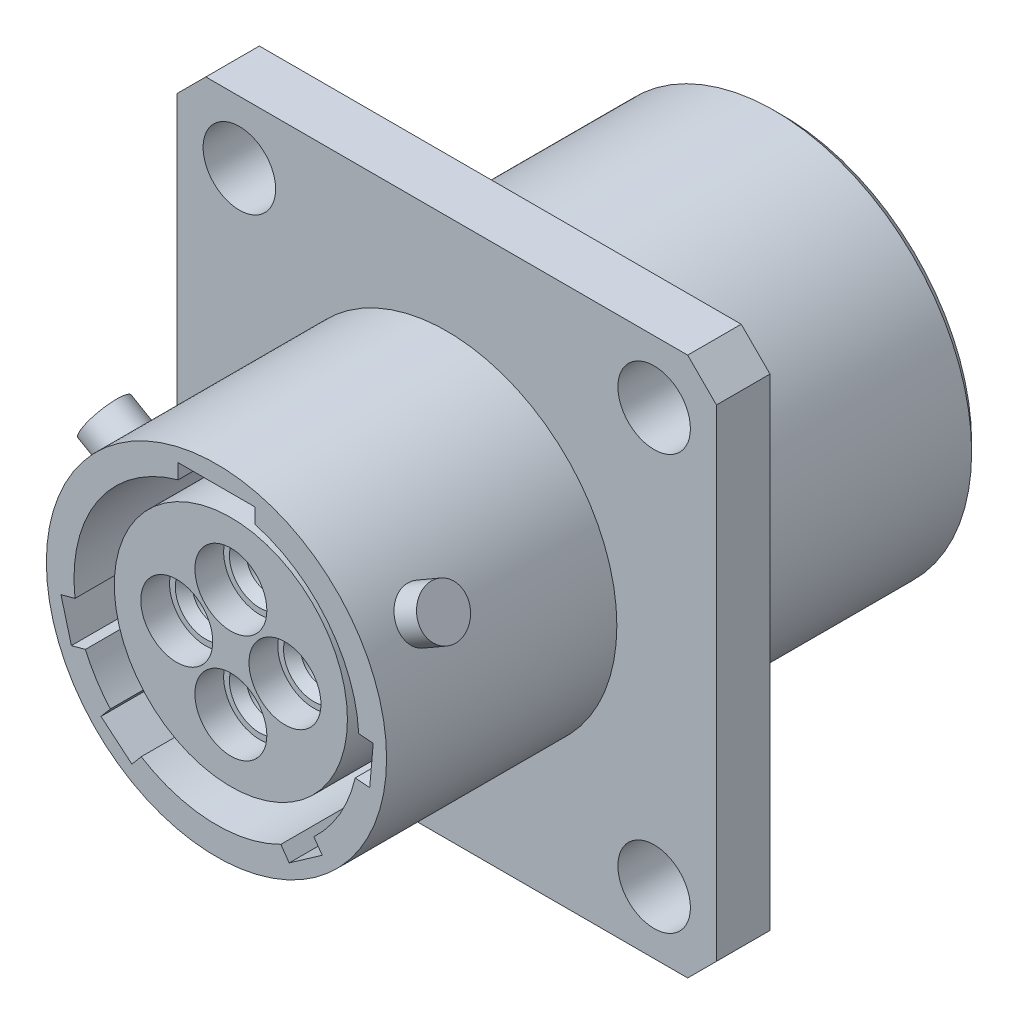
from build123d import *

# Parameters (mm, degrees)
SKETCH3_W               = 22.587
SKETCH3_H               = 5.1435
SKETCH4_W               = 23.8
SKETCH4_H               = 23.8
SKETCH4_R               = 9.15
BOSS_EXTRUDE3_DEPTH     = 2.3622
CHAMFER1_SIZE           = 1.27
SKETCH5_R               = 1.6
CUT_EXTRUDE1_DEPTH      = 2.3622
CUT_EXTRUDE2_DEPTH      = 7.0358
BOSS_EXTRUDE2_START     = -8.636
SKETCH7_R               = 1.0668
BOSS_EXTRUDE2_DEPTH     = 1.2065
CIRPATTERN1_COUNT       = 3
SKETCH8_W               = 1.524
SKETCH8_H               = 1.143
SKETCH10_XS_R           = 1.5875
CUT_EXTRUDE10_XS_DEPTH  = 9.3218
EXTRUDE_THIN10_XS_START = -1.27
SKETCH10_XS_2_R         = 1.5875
SKETCH10_XS_2_R_2       = 0.9525
EXTRUDE_THIN10_XS_DEPTH = 24.365
CHAMFER10_XS_SIZE       = 0.381


with BuildPart() as part:
    # Sketch3 → Revolve1 (revolve)
    with BuildSketch(Plane(origin=(0, 0, 0), x_dir=(0, 0, -1), z_dir=(1, 0, 0)), mode=Mode.PRIVATE) as revolve1_sk:
        Polygon((12.5222, 11.9), (12.5222, 8.7), (24.619, 8.7), (25, 8.319), (25, 6.3119), (23.222, 6.3119), (23.222, 5.1689), (9.9568, 5.1689), (9.9568, 6.2865), (0, 6.2865), (0, 7.5057), (10.16, 7.5057), (10.16, 11.9), align=None)
        with Locations((11.9285, 2.57175)):
            Rectangle(SKETCH3_W, SKETCH3_H)
    revolve(revolve1_sk.sketch.rotate(Axis((0, 0, 0), (0, 0, -1)), 90), axis=Axis((0, 0, 0), (0, 0, -1)))

    # Sketch4 → Boss-Extrude3 (add)
    with BuildSketch(Plane.XY.offset(-10.16)):
        Rectangle(SKETCH4_W, SKETCH4_H)
        Circle(SKETCH4_R, mode=Mode.SUBTRACT)
    extrude(amount=-BOSS_EXTRUDE3_DEPTH)

    # Chamfer1
    chamfer1_edges = [part.edges().sort_by_distance(p)[0] for p in [
        (-11.9, -11.9, -11.3411),
        (-11.9, 11.9, -11.3411),
        (11.9, 11.9, -11.3411),
        (11.9, -11.9, -11.3411),
    ]]
    chamfer(chamfer1_edges, length=CHAMFER1_SIZE)

    # Sketch5 → Cut-Extrude1 (cut)
    with BuildSketch(Plane.XY.offset(-10.16)):
        with Locations((-9.15, 9.15)):
            Circle(SKETCH5_R)
        with Locations((9.15, 9.15)):
            Circle(SKETCH5_R)
        with Locations((9.15, -9.15)):
            Circle(SKETCH5_R)
        with Locations((-9.15, -9.15)):
            Circle(SKETCH5_R)
    extrude(amount=-CUT_EXTRUDE1_DEPTH, mode=Mode.SUBTRACT)

    # Sketch6 → Cut-Extrude2 (cut)
    with BuildSketch(Plane.XY):
        with BuildLine():
            Line((-1.6891, 6.712235353), (1.6891, 6.712235353))
            Line((1.6891, 6.712235353), (1.6891, 6.055330168))
            ThreePointArc((1.6891, 6.055330168), (0, 6.2865), (-1.6891, 6.055330168))
            Line((-1.6891, 6.055330168), (-1.6891, 6.712235353))
        make_face()
        with BuildLine():
            Line((-6.400189754, -2.6352862), (-6.860370017, -0.917870081))
            Line((-6.860370017, -0.917870081), (-6.24135948, -0.752006708))
            ThreePointArc((-6.24135948, -0.752006708), (-6.072292707, -1.627065927), (-5.781179218, -2.469422827))
            Line((-5.781179218, -2.469422827), (-6.400189754, -2.6352862))
        make_face()
        with BuildLine():
            Line((-3.731190453, -5.82969811), (-5.093217473, -4.68682174))
            Line((-5.093217473, -4.68682174), (-4.68128905, -4.195904561))
            ThreePointArc((-4.68128905, -4.195904561), (-4.040884308, -4.815738392), (-3.31926203, -5.338780931))
            Line((-3.31926203, -5.338780931), (-3.731190453, -5.82969811))
        make_face()
        with BuildLine():
            Line((4.665352813, -5.11289012), (3.208900479, -6.132709024))
            Line((3.208900479, -6.132709024), (2.841325818, -5.607758005))
            ThreePointArc((2.841325818, -5.607758005), (3.605788267, -5.149599326), (4.297778153, -4.587939101))
            Line((4.297778153, -4.587939101), (4.665352813, -5.11289012))
        make_face()
        with BuildLine():
            Line((6.915532048, 0.287365179), (6.760569137, -1.483868994))
            Line((6.760569137, -1.483868994), (6.122160889, -1.42801551))
            ThreePointArc((6.122160889, -1.42801551), (6.26257797, -0.547904577), (6.2771238, 0.343218664))
            Line((6.2771238, 0.343218664), (6.915532048, 0.287365179))
        make_face()
    extrude(amount=-CUT_EXTRUDE2_DEPTH, mode=Mode.SUBTRACT)

    # Sketch7 → Boss-Extrude2 (add)
    with BuildSketch(Plane(origin=(0, 0, 0), x_dir=(1, 0, 0), z_dir=(0, 1, 0)).offset(BOSS_EXTRUDE2_START)):
        with Locations(Location((0, 2.54, 0), (0, 0, 90))):
            Circle(SKETCH7_R)
    boss_extrude2 = extrude(amount=BOSS_EXTRUDE2_DEPTH)

    # CirPattern1: Boss-Extrude2 ×3 about axis
    cirpattern1_axis = Axis((0, 0, 0), (0, 0, 1))
    for i in range(1, CIRPATTERN1_COUNT):
        add(boss_extrude2.rotate(cirpattern1_axis, i * 360 / CIRPATTERN1_COUNT))

    # Sketch10-xS → Cut-Extrude10-xS (cut)
    with BuildSketch(Plane.XY.offset(-0.635)):
        with Locations((0, 2.3876)):
            Circle(SKETCH10_XS_R)
        with Locations((2.3876, 0)):
            Circle(SKETCH10_XS_R)
        with Locations((0, -2.3876)):
            Circle(SKETCH10_XS_R)
        with Locations((-2.3876, 0)):
            Circle(SKETCH10_XS_R)
    extrude(amount=-CUT_EXTRUDE10_XS_DEPTH, mode=Mode.SUBTRACT)

    # Sketch10-xS<2> → Extrude-Thin10-xS (add)
    # profile 1 of 4: a face of its own
    with BuildSketch(Plane.XY.offset(-0.635).offset(EXTRUDE_THIN10_XS_START)):
        with Locations((0, 2.3876)):
            Circle(SKETCH10_XS_2_R)
        with Locations((0, 2.3876)):
            Circle(SKETCH10_XS_2_R_2, mode=Mode.SUBTRACT)
    # profile 2 of 4: a face of its own
    with BuildSketch(Plane.XY.offset(-0.635).offset(EXTRUDE_THIN10_XS_START)):
        with Locations((2.3876, 0)):
            Circle(SKETCH10_XS_2_R)
        with Locations((2.3876, 0)):
            Circle(SKETCH10_XS_2_R_2, mode=Mode.SUBTRACT)
    # profile 3 of 4: a face of its own
    with BuildSketch(Plane.XY.offset(-0.635).offset(EXTRUDE_THIN10_XS_START)):
        with Locations((0, -2.3876)):
            Circle(SKETCH10_XS_2_R)
        with Locations((0, -2.3876)):
            Circle(SKETCH10_XS_2_R_2, mode=Mode.SUBTRACT)
    # profile 4 of 4: a face of its own
    with BuildSketch(Plane.XY.offset(-0.635).offset(EXTRUDE_THIN10_XS_START)):
        with Locations((-2.3876, 0)):
            Circle(SKETCH10_XS_2_R)
        with Locations((-2.3876, 0)):
            Circle(SKETCH10_XS_2_R_2, mode=Mode.SUBTRACT)
    extrude(amount=-EXTRUDE_THIN10_XS_DEPTH)

    # Chamfer10-xS
    chamfer10_xs_edges = [part.edges().sort_by_distance(p)[0] for p in [
        (-0.9525, 2.3876, -1.905),
        (1.4351, 0, -1.905),
        (-0.9525, -2.3876, -1.905),
        (-3.3401, 0, -1.905),
    ]]
    chamfer(chamfer10_xs_edges, length=CHAMFER10_XS_SIZE)


with BuildPart() as body_2:
    # Sketch8 → Revolve2 (revolve)
    with BuildSketch(Plane(origin=(0, 0, 0), x_dir=(0, 0, -1), z_dir=(1, 0, 0)), mode=Mode.PRIVATE) as revolve2_sk:
        with Locations((9.1948, 5.715)):
            Rectangle(SKETCH8_W, SKETCH8_H)
    revolve(revolve2_sk.sketch.rotate(Axis((0, 0, -8.4328), (0, 0, -1)), 90), axis=Axis((0, 0, -8.4328), (0, 0, -1)))


solid = Compound([part.part, body_2.part])
